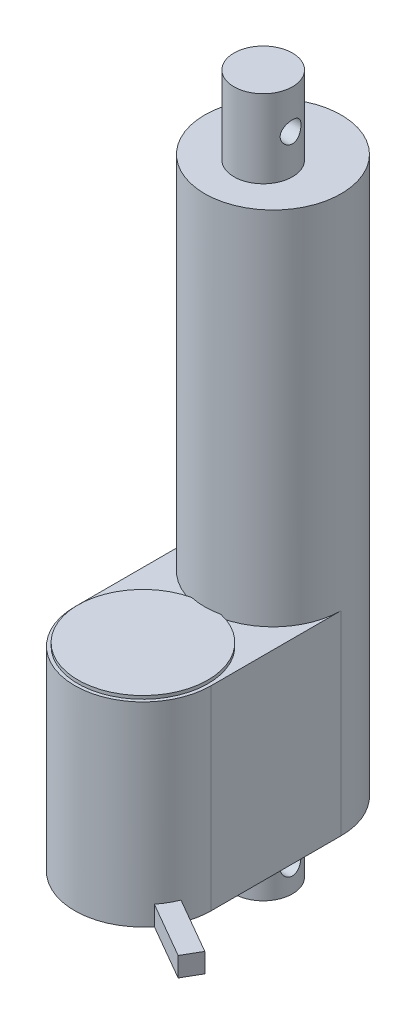
from build123d import *

# Parameters (mm, degrees)
BOSS_EXTRUDE1_DEPTH     = 60
SKETCH2_R               = 20
BOSS_EXTRUDE2_DEPTH     = 1
SKETCH3_R               = 21
BOSS_EXTRUDE3_DEPTH     = 111.072
SKETCH4_R               = 9
BOSS_EXTRUDE4_DEPTH     = 20
CUT_EXTRUDE1_DEPTH      = 187.415206418
CUT_EXTRUDE1_DEPTH_BACK = 187.415206418
SKETCH5_R               = 3.2
BOSS_EXTRUDE5_START     = 24
SKETCH6_R               = 9
BOSS_EXTRUDE5_DEPTH     = 24
CUT_EXTRUDE2_DEPTH      = 209.657818411
CUT_EXTRUDE2_DEPTH_BACK = 209.657818411
SKETCH7_R               = 3.2
BOSS_EXTRUDE6_DEPTH     = 6


with BuildPart() as part:
    # Sketch1 → Boss-Extrude1 (new body)
    with BuildSketch(Plane(origin=(0, 0, 0), x_dir=(1, 0, 0), z_dir=(0, 1, 0))):
        with BuildLine():
            Line((21, 0), (21, -40))
            ThreePointArc((21, -40), (0, -61), (-21, -40))
            Line((-21, -40), (-21, 0))
            ThreePointArc((-21, 0), (0, 21), (21, 0))
        make_face()
    extrude(amount=BOSS_EXTRUDE1_DEPTH)

    # Sketch2 → Boss-Extrude2 (add)
    with BuildSketch(Plane(origin=(0, 60, 0), x_dir=(1, 0, 0), z_dir=(0, 1, 0))):
        with Locations(Location((0, -40, 0), (0, 0, 270))):
            Circle(SKETCH2_R)
    extrude(amount=BOSS_EXTRUDE2_DEPTH)

    # Sketch3 → Boss-Extrude3 (add)
    with BuildSketch(Plane(origin=(0, 60, 0), x_dir=(1, 0, 0), z_dir=(0, 1, 0))):
        with Locations(Location((0, 0, 0), (0, 0, 180))):
            Circle(SKETCH3_R)
    extrude(amount=BOSS_EXTRUDE3_DEPTH)

    # Sketch4 → Boss-Extrude4 (add)
    with BuildSketch(Plane.XZ):
        with Locations(Location((0, 3, 0), (0, 0, 90))):
            Circle(SKETCH4_R)
    extrude(amount=BOSS_EXTRUDE4_DEPTH)

    # Sketch5 → Cut-Extrude1 (cut, two sides: drawn at the far end of the back side and taken through both)
    with BuildSketch(Plane.ZY.offset(21).offset(-CUT_EXTRUDE1_DEPTH_BACK)):
        with Locations((3, -12)):
            Circle(SKETCH5_R)
    extrude(amount=CUT_EXTRUDE1_DEPTH + CUT_EXTRUDE1_DEPTH_BACK, mode=Mode.SUBTRACT)

    # Sketch6 → Boss-Extrude5 (add)
    with BuildSketch(Plane(origin=(0, 171.072, 0), x_dir=(1, 0, 0), z_dir=(0, 1, 0)).offset(BOSS_EXTRUDE5_START)):
        with Locations(Location((0, -3, 0), (0, 0, 270))):
            Circle(SKETCH6_R)
    extrude(amount=-BOSS_EXTRUDE5_DEPTH)

    # Sketch7 → Cut-Extrude2 (cut, two sides: drawn at the far end of the back side and taken through both)
    with BuildSketch(Plane.ZY.offset(21).offset(-CUT_EXTRUDE2_DEPTH_BACK)):
        with Locations((3, 183.072)):
            Circle(SKETCH7_R)
    extrude(amount=CUT_EXTRUDE2_DEPTH + CUT_EXTRUDE2_DEPTH_BACK, mode=Mode.SUBTRACT)

    # Sketch8 → Boss-Extrude6 (add)
    with BuildSketch(Plane.XZ):
        Polygon((19.5, 47.794228634), (36.820508076, 57.794228634), (33.820508076, 62.990381057), (16.5, 52.990381057), align=None)
    extrude(amount=-BOSS_EXTRUDE6_DEPTH)


solid = part.part
